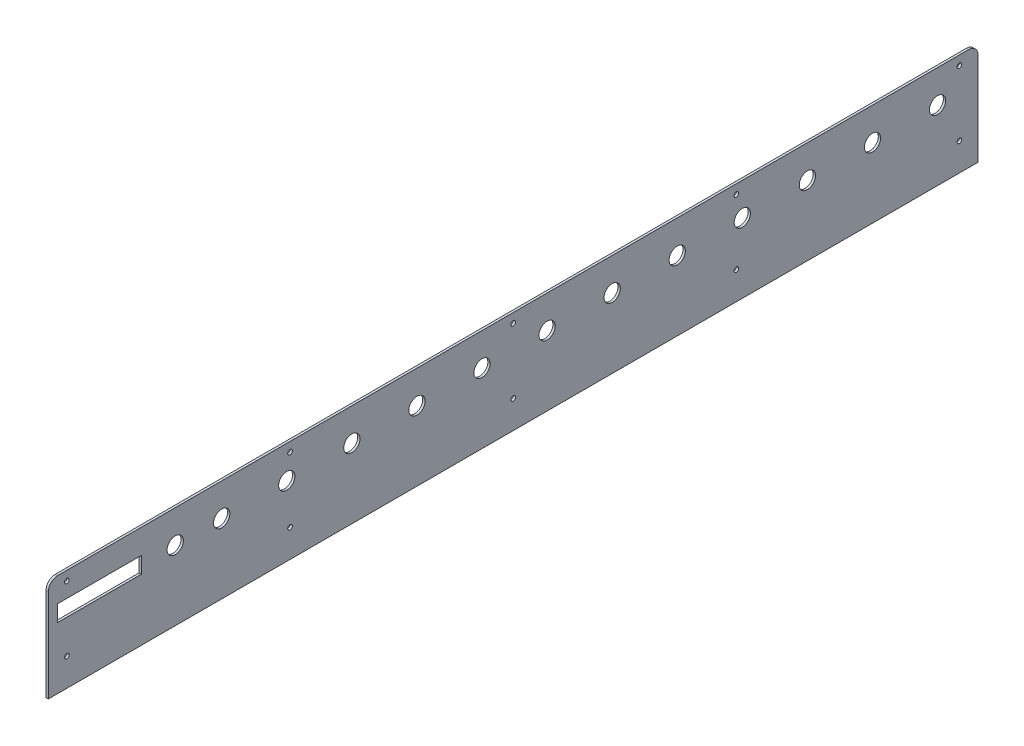
from build123d import *

# Parameters (mm, degrees)
SKETCH1_R           = 8.75
SKETCH1_W           = 90
SKETCH1_H           = 17.5
BOSS_EXTRUDE1_DEPTH = 2.5
SKETCH2_R           = 2.5
CUT_EXTRUDE1_DEPTH  = 1007.034914901


with BuildPart() as part:
    # Sketch1 → Boss-Extrude1 (new body)
    with BuildSketch(Plane(origin=(2.5, 0, 0), x_dir=(0, 0, -1), z_dir=(1, 0, 0))):
        with BuildLine():
            Line((1000, 0), (1000, 100))
            ThreePointArc((1000, 100), (997.071067812, 107.071067812), (990, 110))
            Line((990, 110), (10, 110))
            ThreePointArc((10, 110), (2.928932188, 107.071067812), (0, 100))
            Line((0, 100), (0, 0))
            Line((0, 0), (1000, 0))
        make_face()
        with Locations(Location((136.5, 75, 0), (0, 0, 180))):
            Circle(SKETCH1_R, mode=Mode.SUBTRACT)
        with Locations(Location((186.5, 75, 0), (0, 0, 180))):
            Circle(SKETCH1_R, mode=Mode.SUBTRACT)
        with Locations(Location((256.5, 75, 0), (0, 0, 180))):
            Circle(SKETCH1_R, mode=Mode.SUBTRACT)
        with Locations(Location((326.5, 75, 0), (0, 0, 180))):
            Circle(SKETCH1_R, mode=Mode.SUBTRACT)
        with Locations(Location((396.5, 75, 0), (0, 0, 180))):
            Circle(SKETCH1_R, mode=Mode.SUBTRACT)
        with Locations(Location((466.5, 75, 0), (0, 0, 180))):
            Circle(SKETCH1_R, mode=Mode.SUBTRACT)
        with Locations(Location((536.5, 75, 0), (0, 0, 180))):
            Circle(SKETCH1_R, mode=Mode.SUBTRACT)
        with Locations(Location((606.5, 75, 0), (0, 0, 180))):
            Circle(SKETCH1_R, mode=Mode.SUBTRACT)
        with Locations(Location((676.5, 75, 0), (0, 0, 180))):
            Circle(SKETCH1_R, mode=Mode.SUBTRACT)
        with Locations(Location((746.5, 75, 0), (0, 0, 180))):
            Circle(SKETCH1_R, mode=Mode.SUBTRACT)
        with Locations(Location((816.5, 75, 0), (0, 0, 180))):
            Circle(SKETCH1_R, mode=Mode.SUBTRACT)
        with Locations(Location((886.5, 75, 0), (0, 0, 180))):
            Circle(SKETCH1_R, mode=Mode.SUBTRACT)
        with Locations(Location((956.5, 75, 0), (0, 0, 180))):
            Circle(SKETCH1_R, mode=Mode.SUBTRACT)
        with Locations((55, 75)):
            Rectangle(SKETCH1_W, SKETCH1_H, mode=Mode.SUBTRACT)
    extrude(amount=-BOSS_EXTRUDE1_DEPTH)

    # Sketch2 → Cut-Extrude1 (cut, through all)
    with BuildSketch(Plane(origin=(2.5, 0, 0), x_dir=(0, 0, -1), z_dir=(1, 0, 0))):
        with Locations((500, 100)):
            Circle(SKETCH2_R)
        with Locations((20, 100)):
            Circle(SKETCH2_R)
        with Locations((980, 100)):
            Circle(SKETCH2_R)
        with Locations((980, 30)):
            Circle(SKETCH2_R)
        with Locations((500, 30)):
            Circle(SKETCH2_R)
        with Locations((20, 30)):
            Circle(SKETCH2_R)
        with Locations((260, 100)):
            Circle(SKETCH2_R)
        with Locations((260, 30)):
            Circle(SKETCH2_R)
        with Locations((740, 100)):
            Circle(SKETCH2_R)
        with Locations((740, 30)):
            Circle(SKETCH2_R)
    extrude(amount=-CUT_EXTRUDE1_DEPTH, mode=Mode.SUBTRACT)


solid = part.part
